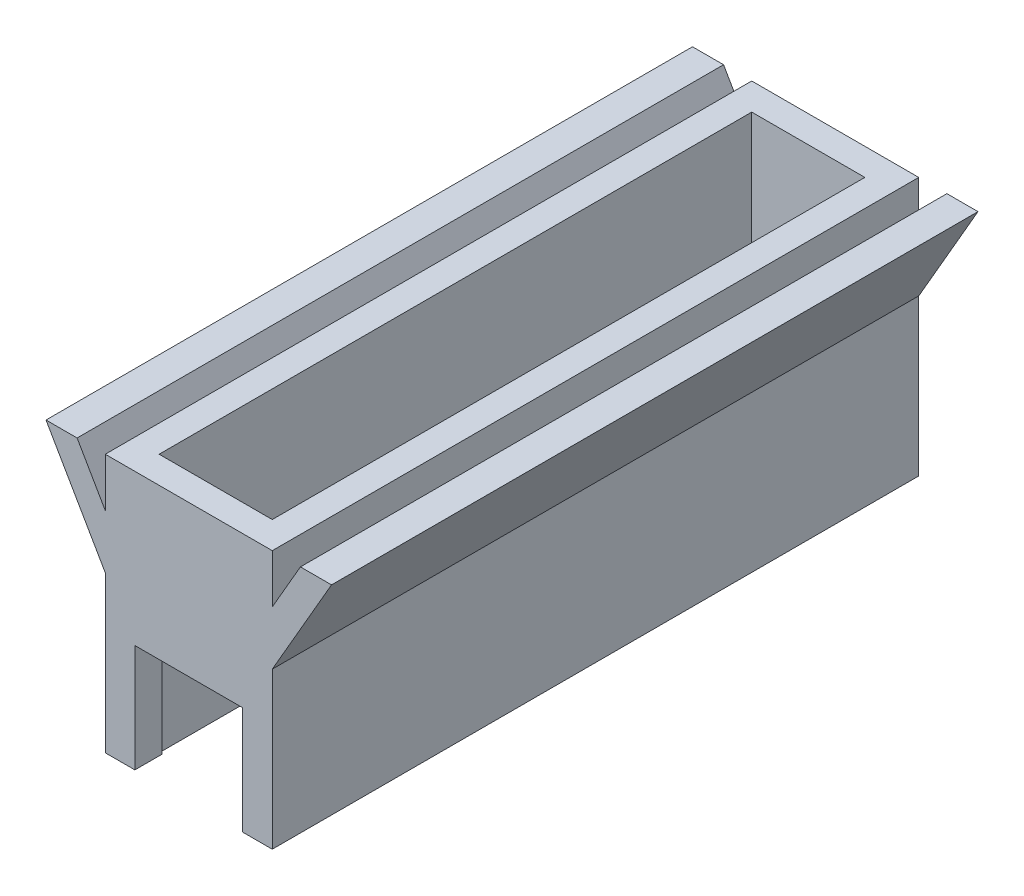
from build123d import *

# Parameters (mm, degrees)
SKETCH1_W           = 31
SKETCH1_H           = 120
SKETCH1_W_2         = 21
SKETCH1_H_2         = 110
BOSS_EXTRUDE4_DEPTH = 48
SKETCH6_W           = 20
SKETCH6_H           = 20
CUT_EXTRUDE3_DEPTH  = 136
BOSS_EXTRUDE5_DEPTH = 120


with BuildPart() as part:
    # Sketch1 → Boss-Extrude4 (new body)
    with BuildSketch(Plane(origin=(0, 0, 0), x_dir=(1, 0, 0), z_dir=(0, 1, 0))):
        with Locations((8.759280296, -55.007974482)):
            Rectangle(SKETCH1_W, SKETCH1_H)
        with Locations((8.759280296, -55.007974482)):
            Rectangle(SKETCH1_W_2, SKETCH1_H_2, mode=Mode.SUBTRACT)
    extrude(amount=BOSS_EXTRUDE4_DEPTH)

    # Sketch6 → Cut-Extrude3 (cut)
    with BuildSketch(Plane.XY.offset(115.007974482)):
        with Locations((8.759280296, 10)):
            Rectangle(SKETCH6_W, SKETCH6_H)
    extrude(amount=-CUT_EXTRUDE3_DEPTH, mode=Mode.SUBTRACT)

    # Sketch7 → Boss-Extrude5 (add)
    with BuildSketch(Plane.XY.offset(115.007974482)):
        Polygon((-6.740719704, 38.947441117), (-11.967217013, 48), (-17.740719704, 48), (-6.740719704, 28.947441117), align=None)
        Polygon((24.259280296, 38.947441117), (24.259280296, 28.947441117), (35.259280296, 48), (29.485777604, 48), align=None)
    extrude(amount=-BOSS_EXTRUDE5_DEPTH)


solid = part.part
